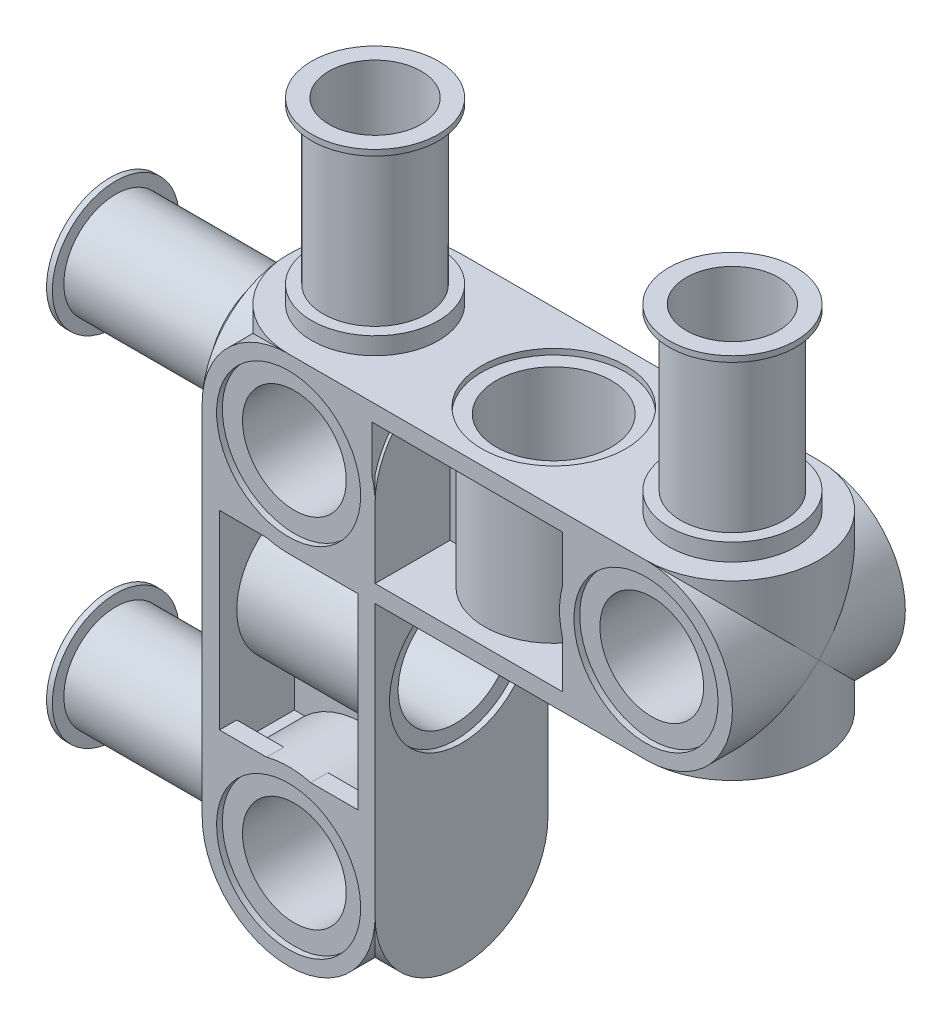
from build123d import *
from build123d.topology import SkipClean

# Parameters (mm, degrees)
EXTRUDE1_DEPTH       = 3.81
SKETCH2_R            = 2.794
CUT_EXTRUDE1_DEPTH   = 0.254
SKETCH3_R            = 2.794
EXTRUDE2_DEPTH       = 0.762
SKETCH5_R            = 2.286
SKETCH5_R_2          = 2.032
EXTRUDE4_DEPTH       = 7.112
EXTRUDE5_START       = -0.254
SKETCH6_R            = 2.794
SKETCH6_R_2          = 2.032
EXTRUDE5_DEPTH       = 0.254
EXTRUDE6_DEPTH       = 7.62
SKETCH8_R            = 2.54
CUT_EXTRUDE2_DEPTH   = 3.556
SKETCH9_R            = 2.286
CUT_EXTRUDE3_DEPTH   = 17.018118866
SKETCH10_R           = 3.175
CUT_EXTRUDE4_DEPTH   = 0.254
CUT_EXTRUDE6_DEPTH   = 3.048
SKETCH13_R           = 2.54
CUT_EXTRUDE7_DEPTH   = 15.734189492
SKETCH14_R           = 3.175
CUT_EXTRUDE8_DEPTH   = 0.254
EXTRUDE8_START       = -7.112
EXTRUDE8_DEPTH       = 7.112
EXTRUDE10_DEPTH      = 21.848124424
EXTRUDE10_DEPTH_BACK = 21.848124424
CIRPATTERN1_COUNT    = 2
CIRPATTERN1_ANGLE    = 90


with BuildPart() as part:
    # Sketch1 → Extrude1 (new body)
    with BuildSketch(Plane(origin=(0, 0, 0), x_dir=(1, 0, 0), z_dir=(0, 1, 0))):
        with BuildLine():
            Line((-7.874, 3.81), (7.874, 3.81))
            ThreePointArc((7.874, 3.81), (11.684, 0), (7.874, -3.81))
            Line((7.874, -3.81), (-7.874, -3.81))
            ThreePointArc((-7.874, -3.81), (-11.684, 0), (-7.874, 3.81))
        make_face()
    extrude(amount=EXTRUDE1_DEPTH)

    # Sketch2 → Cut-Extrude1 (cut)
    with BuildSketch(Plane.XZ):
        Circle(SKETCH2_R)
    extrude(amount=-CUT_EXTRUDE1_DEPTH, mode=Mode.SUBTRACT)

    # Sketch3 → Extrude2 (add)
    with BuildSketch(Plane.XZ):
        with Locations((7.874, 0)):
            Circle(SKETCH3_R)
        with Locations((-7.874, 0)):
            Circle(SKETCH3_R)
    extrude(amount=EXTRUDE2_DEPTH)

    # Sketch5 → Extrude4 (add)
    # profile 1 of 2: a face of its own
    with BuildSketch(Plane.XZ.offset(0.762)):
        with Locations((7.874, 0)):
            Circle(SKETCH5_R)
        with Locations((7.874, 0)):
            Circle(SKETCH5_R_2, mode=Mode.SUBTRACT)
    # profile 2 of 2: a face of its own
    with BuildSketch(Plane.XZ.offset(0.762)):
        with Locations((-7.874, 0)):
            Circle(SKETCH5_R)
        with Locations((-7.874, 0)):
            Circle(SKETCH5_R_2, mode=Mode.SUBTRACT)
    extrude(amount=EXTRUDE4_DEPTH)

    # Sketch6 → Extrude5 (add)
    # profile 1 of 2: a face of its own
    with BuildSketch(Plane.XZ.offset(7.874).offset(EXTRUDE5_START)):
        with Locations((-7.874, 0)):
            Circle(SKETCH6_R)
        with Locations((-7.874, 0)):
            Circle(SKETCH6_R_2, mode=Mode.SUBTRACT)
    # profile 2 of 2: a face of its own
    with BuildSketch(Plane.XZ.offset(7.874).offset(EXTRUDE5_START)):
        with Locations((7.874, 0)):
            Circle(SKETCH6_R)
        with Locations((7.874, 0)):
            Circle(SKETCH6_R_2, mode=Mode.SUBTRACT)
    extrude(amount=EXTRUDE5_DEPTH)

    # Sketch7 → Extrude6 (add)
    with BuildSketch(Plane(origin=(0, 0, -3.81), x_dir=(-1, 0, 0), z_dir=(0, 0, -1))):
        with BuildLine():
            Line((-7.874, 0), (7.874, 0))
            ThreePointArc((7.874, 0), (10.568076836, 1.115923164), (11.684, 3.81))
            Line((11.684, 3.81), (7.874, 3.81))
            Line((7.874, 3.81), (-7.874, 3.81))
            Line((-7.874, 3.81), (-11.684, 3.81))
            ThreePointArc((-11.684, 3.81), (-10.568076836, 1.115923164), (-7.874, 0))
        make_face()
    extrude(amount=-EXTRUDE6_DEPTH)

    # Sketch8 → Cut-Extrude2 (cut)
    with BuildSketch(Plane(origin=(0, 3.81, 0), x_dir=(1, 0, 0), z_dir=(0, 1, 0))):
        Circle(SKETCH8_R)
    extrude(amount=-CUT_EXTRUDE2_DEPTH, mode=Mode.SUBTRACT)

    # Sketch9 → Cut-Extrude3 (cut, through all)
    with BuildSketch(Plane.XY.offset(3.81)):
        with Locations((7.874, 3.81)):
            Circle(SKETCH9_R)
        with Locations((-7.874, 3.81)):
            Circle(SKETCH9_R)
    extrude(amount=-CUT_EXTRUDE3_DEPTH, mode=Mode.SUBTRACT)

    # Sketch10 → Cut-Extrude4 (cut)
    with BuildSketch(Plane.XY.offset(3.81)):
        with Locations((7.874, 3.81)):
            Circle(SKETCH10_R)
        with Locations((-7.874, 3.81)):
            Circle(SKETCH10_R)
    cut_extrude4 = extrude(amount=-CUT_EXTRUDE4_DEPTH, mode=Mode.SUBTRACT)

    # Mirror2: Cut-Extrude4 across plane
    add(cut_extrude4.mirror(Plane.XY), mode=Mode.SUBTRACT)

    # Sketch11 → Cut-Extrude6 (cut)
    with BuildSketch(Plane(origin=(0, 3.81, 0), x_dir=(1, 0, 0), z_dir=(0, 1, 0))):
        with BuildLine():
            Line((-5.08, -0.508), (-5.08, -3.048))
            Line((-5.08, -3.048), (-4.191, -3.048))
            Line((-4.191, -3.048), (-4.191, -3.81))
            Line((-4.191, -3.81), (4.191, -3.81))
            Line((4.191, -3.81), (4.191, -3.048))
            Line((4.191, -3.048), (5.08, -3.048))
            Line((5.08, -3.048), (5.08, -0.508))
            Line((5.08, -0.508), (3.00536853, -0.508))
            ThreePointArc((3.00536853, -0.508), (0, -3.048), (-3.00536853, -0.508))
            Line((-3.00536853, -0.508), (-5.08, -0.508))
        make_face()
        with BuildLine():
            Line((5.08, 0.508), (5.08, 3.048))
            Line((5.08, 3.048), (4.191, 3.048))
            Line((4.191, 3.048), (4.191, 3.81))
            Line((4.191, 3.81), (-4.191, 3.81))
            Line((-4.191, 3.81), (-4.191, 3.048))
            Line((-4.191, 3.048), (-5.08, 3.048))
            Line((-5.08, 3.048), (-5.08, 0.508))
            Line((-5.08, 0.508), (-3.00536853, 0.508))
            ThreePointArc((-3.00536853, 0.508), (0, 3.048), (3.00536853, 0.508))
            Line((3.00536853, 0.508), (5.08, 0.508))
        make_face()
    extrude(amount=-CUT_EXTRUDE6_DEPTH, mode=Mode.SUBTRACT)

    # Sketch13 → Cut-Extrude7 (cut, through all)
    with BuildSketch(Plane(origin=(0, 0.254, 0), x_dir=(1, 0, 0), z_dir=(0, 1, 0))):
        Circle(SKETCH13_R)
    extrude(amount=-CUT_EXTRUDE7_DEPTH, mode=Mode.SUBTRACT)

    # Sketch14 → Cut-Extrude8 (cut)
    with BuildSketch(Plane.XZ):
        Circle(SKETCH14_R)
    extrude(amount=-CUT_EXTRUDE8_DEPTH, mode=Mode.SUBTRACT)

    # Sketch17 → Extrude8 (add)
    with BuildSketch(Plane.XY.offset(3.81).offset(EXTRUDE8_START)):
        with BuildLine():
            Line((-4.064, 3.81), (-4.699, 3.81))
            ThreePointArc((-4.699, 3.81), (-7.874, 0.635), (-11.049, 3.81))
            Line((-11.049, 3.81), (-11.684, 3.81))
            ThreePointArc((-11.684, 3.81), (-7.874, 0), (-4.064, 3.81))
        make_face()
    extrude8 = extrude(amount=EXTRUDE8_DEPTH)

    # Mirror3: Extrude8 across plane
    add(extrude8.mirror(Plane(origin=(0, 0, 0), x_dir=(0, 0, 1), z_dir=(1, 0, 0))))

    # Mirror1: part across plane


with BuildPart() as part_1:
    with SkipClean():  # the faces are left unmerged after this step: merging them gives an invalid solid
        add(part.part)
        add(part.part.mirror(Plane(origin=(-7.874, 3.81, 0), x_dir=(0, 0, 1), z_dir=(0, 1, 0))))

    # Sketch18 → Extrude10 (cut, two sides: drawn at the far end of the back side and taken through both)
    with SkipClean():  # the faces are left unmerged after this step: merging them gives an invalid solid
        with BuildSketch(Plane.XY.offset(3.81).offset(-EXTRUDE10_DEPTH_BACK)):
            Polygon((-86.944177943, 0), (-14.134519373, 0), (15.632648155, 0), (88.442306725, 0), (88.442306725, -145.61931714), (-86.944177943, -145.61931714), align=None)
        extrude(amount=EXTRUDE10_DEPTH + EXTRUDE10_DEPTH_BACK, mode=Mode.SUBTRACT)


with BuildPart() as cirpattern1_1:
    # CirPattern1: pattern copy
    add(part_1.part.rotate(Axis((-7.874, 3.81, 3.556), (0, 0, -1)), 1 * CIRPATTERN1_ANGLE / (CIRPATTERN1_COUNT - 1)))


with BuildPart() as body_3:
    # Mirror4: mirrored copy
    add(cirpattern1_1.part.mirror(Plane(origin=(-7.874, 0, 0), x_dir=(0, 0, 1), z_dir=(1, 0, 0))))


with BuildPart() as part_2:
    add(part_1.part)

    # Combine1: union body 3
    add(body_3.part)


solid = part_2.part
